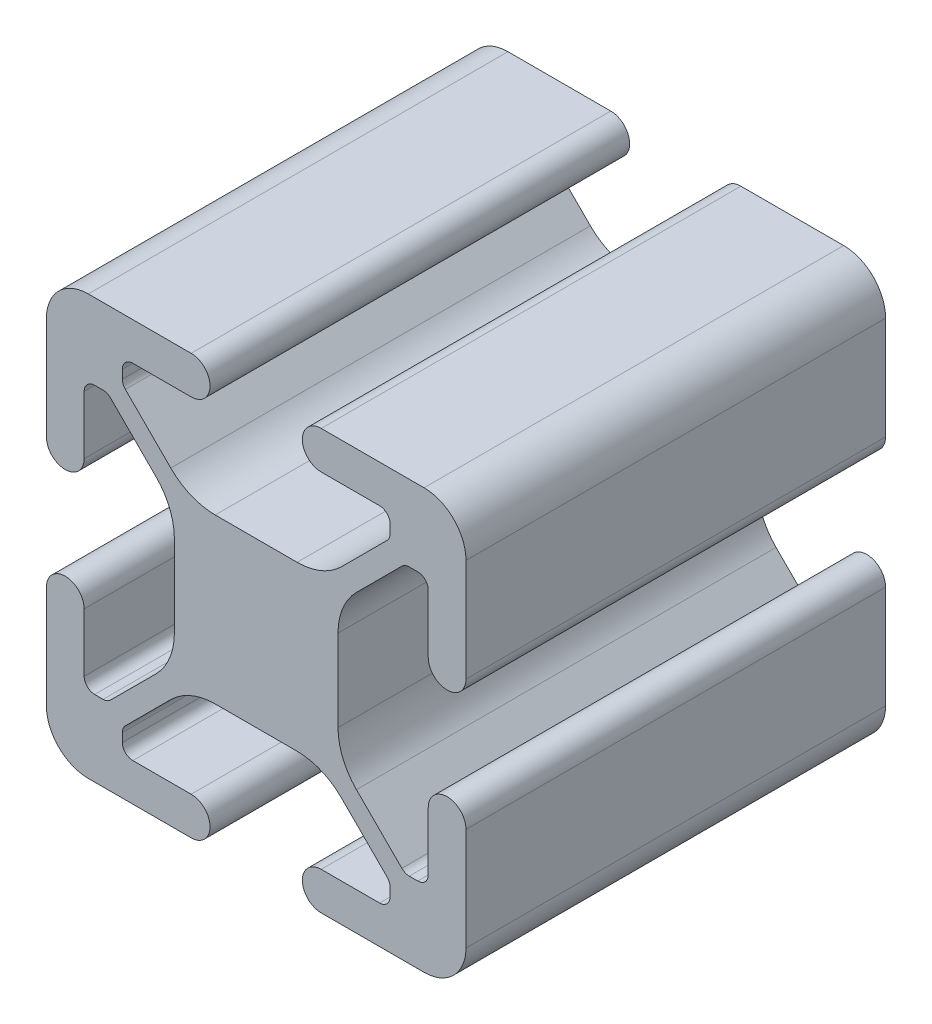
from build123d import *

# Parameters (mm, degrees)
EXTRUDE_1_DEPTH = 20


with BuildPart() as part:
    # 草图2 → 凸台-拉伸1 (new body)
    with BuildSketch(Plane.XY):
        with BuildLine():
            Line((-1.042752475, -10.085861632), (3.857247525, -10.085861632))
            ThreePointArc((3.857247525, -10.085861632), (4.757247525, -10.985861632), (3.857247525, -11.885861632))
            Line((3.857247525, -11.885861632), (1.076161722, -11.885861632))
            ThreePointArc((1.076161722, -11.885861632), (0.722608332, -12.032308241), (0.576161722, -12.385861632))
            Line((0.576161722, -12.385861632), (0.576161722, -12.790788968))
            ThreePointArc((0.576161722, -12.790788968), (0.614221956, -12.982130685), (0.722608332, -13.144342359))
            Line((0.722608332, -13.144342359), (2.885447948, -15.307181975))
            ThreePointArc((2.885447948, -15.307181975), (3.858717994, -15.957500229), (5.006768291, -16.185861632))
            Line((5.006768291, -16.185861632), (8.907726758, -16.185861632))
            ThreePointArc((8.907726758, -16.185861632), (10.055777055, -15.957500229), (11.029047102, -15.307181975))
            Line((11.029047102, -15.307181975), (13.191886718, -13.144342359))
            ThreePointArc((13.191886718, -13.144342359), (13.300273094, -12.982130685), (13.338333327, -12.790788968))
            Line((13.338333327, -12.790788968), (13.338333327, -12.385861632))
            ThreePointArc((13.338333327, -12.385861632), (13.191886718, -12.032308241), (12.838333327, -11.885861632))
            Line((12.838333327, -11.885861632), (10.057247525, -11.885861632))
            ThreePointArc((10.057247525, -11.885861632), (9.157247525, -10.985861632), (10.057247525, -10.085861632))
            Line((10.057247525, -10.085861632), (14.957247525, -10.085861632))
            ThreePointArc((14.957247525, -10.085861632), (16.371461087, -10.671648069), (16.957247525, -12.085861632))
            Line((16.957247525, -12.085861632), (16.957247525, -16.985861632))
            ThreePointArc((16.957247525, -16.985861632), (16.057247525, -17.885861632), (15.157247525, -16.985861632))
            Line((15.157247525, -16.985861632), (15.157247525, -14.204775829))
            ThreePointArc((15.157247525, -14.204775829), (15.010800915, -13.851222438), (14.657247525, -13.704775829))
            Line((14.657247525, -13.704775829), (14.252320188, -13.704775829))
            ThreePointArc((14.252320188, -13.704775829), (14.060978472, -13.742836063), (13.898766797, -13.851222438))
            Line((13.898766797, -13.851222438), (11.735927181, -16.014062054))
            ThreePointArc((11.735927181, -16.014062054), (11.085608927, -16.987332101), (10.857247525, -18.135382398))
            Line((10.857247525, -18.135382398), (10.857247525, -22.036340865))
            ThreePointArc((10.857247525, -22.036340865), (11.085608927, -23.184391162), (11.735927181, -24.157661209))
            Line((11.735927181, -24.157661209), (13.898766797, -26.320500825))
            ThreePointArc((13.898766797, -26.320500825), (14.060978472, -26.4288872), (14.252320188, -26.466947434))
            Line((14.252320188, -26.466947434), (14.657247525, -26.466947434))
            ThreePointArc((14.657247525, -26.466947434), (15.010800915, -26.320500825), (15.157247525, -25.966947434))
            Line((15.157247525, -25.966947434), (15.157247525, -23.185861632))
            ThreePointArc((15.157247525, -23.185861632), (16.057247525, -22.285861632), (16.957247525, -23.185861632))
            Line((16.957247525, -23.185861632), (16.957247525, -28.085861632))
            ThreePointArc((16.957247525, -28.085861632), (16.371461087, -29.500075194), (14.957247525, -30.085861632))
            Line((14.957247525, -30.085861632), (10.057247525, -30.085861632))
            ThreePointArc((10.057247525, -30.085861632), (9.157247525, -29.185861632), (10.057247525, -28.285861632))
            Line((10.057247525, -28.285861632), (12.838333327, -28.285861632))
            ThreePointArc((12.838333327, -28.285861632), (13.191886718, -28.139415022), (13.338333327, -27.785861632))
            Line((13.338333327, -27.785861632), (13.338333327, -27.380934295))
            ThreePointArc((13.338333327, -27.380934295), (13.300273094, -27.189592579), (13.191886718, -27.027380904))
            Line((13.191886718, -27.027380904), (11.029047102, -24.864541288))
            ThreePointArc((11.029047102, -24.864541288), (10.055777055, -24.214223034), (8.907726758, -23.985861632))
            Line((8.907726758, -23.985861632), (5.006768291, -23.985861632))
            ThreePointArc((5.006768291, -23.985861632), (3.858717994, -24.214223034), (2.885447948, -24.864541288))
            Line((2.885447948, -24.864541288), (0.722608332, -27.027380904))
            ThreePointArc((0.722608332, -27.027380904), (0.614221956, -27.189592579), (0.576161722, -27.380934295))
            Line((0.576161722, -27.380934295), (0.576161722, -27.785861632))
            ThreePointArc((0.576161722, -27.785861632), (0.722608332, -28.139415022), (1.076161722, -28.285861632))
            Line((1.076161722, -28.285861632), (3.857247525, -28.285861632))
            ThreePointArc((3.857247525, -28.285861632), (4.757247525, -29.185861632), (3.857247525, -30.085861632))
            Line((3.857247525, -30.085861632), (-1.042752475, -30.085861632))
            ThreePointArc((-1.042752475, -30.085861632), (-2.456966038, -29.500075194), (-3.042752475, -28.085861632))
            Line((-3.042752475, -28.085861632), (-3.042752475, -23.185861632))
            ThreePointArc((-3.042752475, -23.185861632), (-2.142752475, -22.285861632), (-1.242752475, -23.185861632))
            Line((-1.242752475, -23.185861632), (-1.242752475, -25.966947434))
            ThreePointArc((-1.242752475, -25.966947434), (-1.096305866, -26.320500825), (-0.742752475, -26.466947434))
            Line((-0.742752475, -26.466947434), (-0.337825138, -26.466947434))
            ThreePointArc((-0.337825138, -26.466947434), (-0.146483422, -26.4288872), (0.015728252, -26.320500825))
            Line((0.015728252, -26.320500825), (2.178567868, -24.157661209))
            ThreePointArc((2.178567868, -24.157661209), (2.828886122, -23.184391162), (3.057247525, -22.036340865))
            Line((3.057247525, -22.036340865), (3.057247525, -18.135382398))
            ThreePointArc((3.057247525, -18.135382398), (2.828886122, -16.987332101), (2.178567868, -16.014062054))
            Line((2.178567868, -16.014062054), (0.015728252, -13.851222438))
            ThreePointArc((0.015728252, -13.851222438), (-0.146483422, -13.742836063), (-0.337825138, -13.704775829))
            Line((-0.337825138, -13.704775829), (-0.742752475, -13.704775829))
            ThreePointArc((-0.742752475, -13.704775829), (-1.096305866, -13.851222438), (-1.242752475, -14.204775829))
            Line((-1.242752475, -14.204775829), (-1.242752475, -16.985861632))
            ThreePointArc((-1.242752475, -16.985861632), (-2.142752475, -17.885861632), (-3.042752475, -16.985861632))
            Line((-3.042752475, -16.985861632), (-3.042752475, -12.085861632))
            ThreePointArc((-3.042752475, -12.085861632), (-2.456966038, -10.671648069), (-1.042752475, -10.085861632))
        make_face()
    extrude(amount=EXTRUDE_1_DEPTH)


solid = part.part
